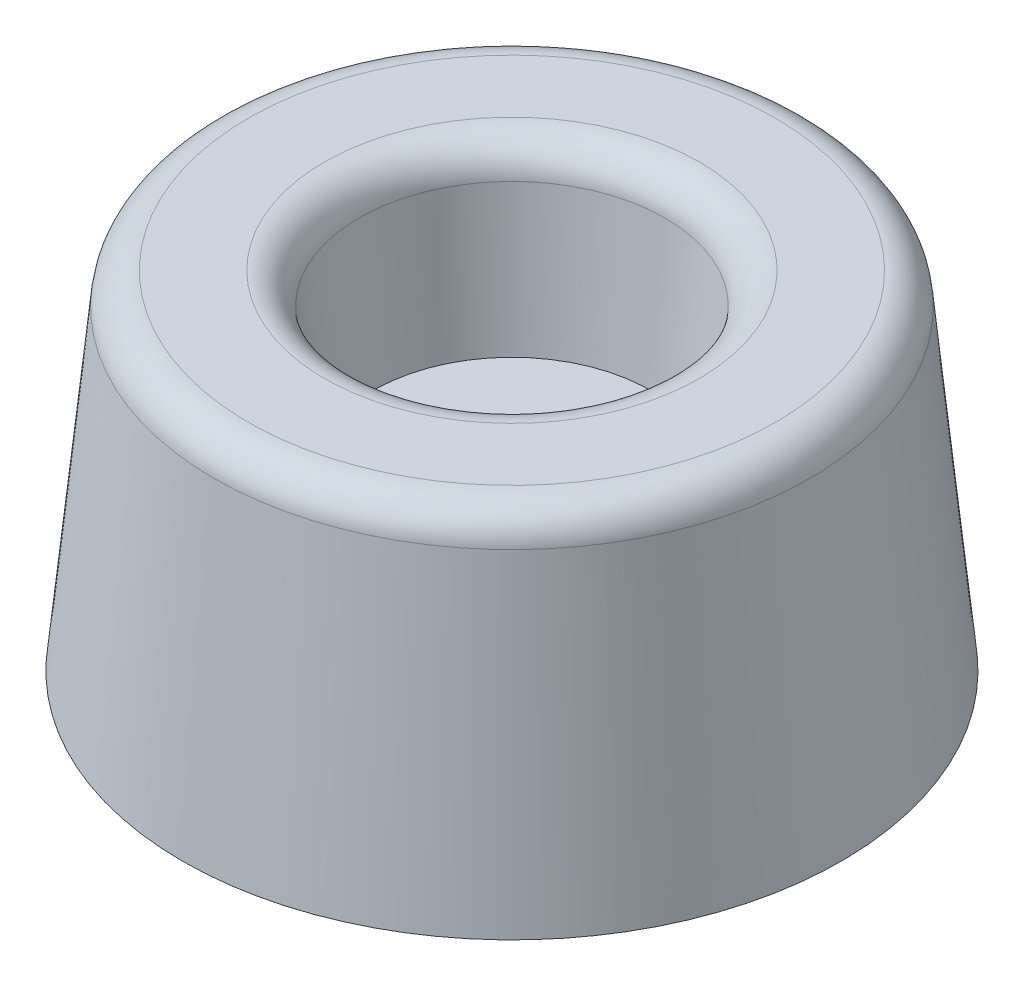
from build123d import *

# Parameters (mm, degrees)
FILLET1_R = 1


with BuildPart() as part:
    # Sketch1 → Revolve1 (revolve)
    with BuildSketch(Plane.XY, mode=Mode.PRIVATE) as revolve1_sk:
        Polygon((0, 0), (9.5, 0), (8.5, 10), (4.5, 10), (4, 5), (0, 5), align=None)
    revolve(revolve1_sk.sketch.rotate(Axis((0, 27.669982315, 0), (0, -1, 0)), 90), axis=Axis((0, 27.669982315, 0), (0, -1, 0)))

    # Fillet1
    fillet1_edges = [part.edges().sort_by_distance(p)[0] for p in [
        (0, 10, -4.5),
        (0, 10, -8.5),
    ]]
    fillet(fillet1_edges, radius=FILLET1_R)


solid = part.part
